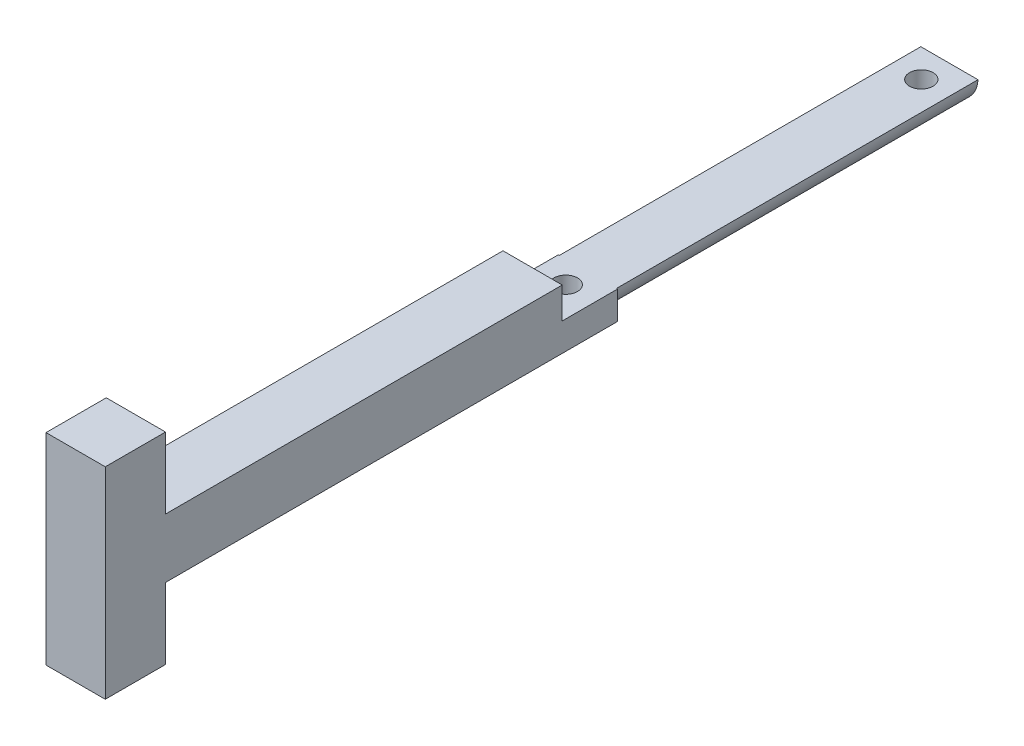
from build123d import *

# Parameters (mm, degrees)
SKETCH_1_R           = 2.85
EXTRUDE_1_DEPTH      = 31
SKETCH_3_W           = 5.9
SKETCH_3_H           = 5.9
EXTRUDE_2_DEPTH      = 5
SKETCH_4_R           = 5
EXTRUDE_3_DEPTH      = 7
SKETCH_6_R           = 11.5
EXTRUDE_4_DEPTH      = 2
SKETCH_8_R           = 4.5
CUT_EXTRUDE_2_DEPTH  = 7.5
SKETCH_9_R           = 1.25
CUT_EXTRUDE_3_DEPTH  = 5.5
SKETCH_10_R          = 1.175
CUT_EXTRUDE_7_DEPTH  = 10
SKETCH_12_W          = 5.9
SKETCH_12_H          = 5.9
EXTRUDE_5_DEPTH      = 45
SKETCH_15_W          = 5.9
SKETCH_15_H          = 20.04910328
EXTRUDE_6_DEPTH      = 6
SKETCH_16_R          = 1.175
CUT_EXTRUDE_8_DEPTH  = 10
SKETCH_21_W          = 41.5
SKETCH_21_H          = 3.1
CUT_EXTRUDE_9_DEPTH  = 10
SKETCH_22_OUTSIDE_W  = 45.272
SKETCH_22_OUTSIDE_H  = 45.272
SKETCH_22_OUTSIDE_R  = 2.85
CUT_EXTRUDE_10_DEPTH = 5
SKETCH_23_R          = 14.411618967
CUT_EXTRUDE_11_DEPTH = 9


with BuildPart() as part:
    # 스케치1 → 보스-돌출1 (new body)
    with BuildSketch(Plane.XY):
        Circle(SKETCH_1_R)
    extrude(amount=EXTRUDE_1_DEPTH)

    # 스케치3 → 보스-돌출2 (add)
    with BuildSketch(Plane(origin=(0, 0, 0), x_dir=(-1, 0, 0), z_dir=(0, 0, -1))):
        Rectangle(SKETCH_3_W, SKETCH_3_H)
    extrude(amount=EXTRUDE_2_DEPTH)

    # 스케치4 → 보스-돌출3 (add)
    with BuildSketch(Plane(origin=(0, 0, -5), x_dir=(-1, 0, 0), z_dir=(0, 0, -1))):
        Circle(SKETCH_4_R)
    extrude(amount=EXTRUDE_3_DEPTH)

    # 스케치6 → 보스-돌출4 (add)
    with BuildSketch(Plane(origin=(0, 0, -12), x_dir=(-1, 0, 0), z_dir=(0, 0, -1))):
        Circle(SKETCH_6_R)
    extrude(amount=EXTRUDE_4_DEPTH)

    # 스케치8 → 컷-돌출2 (cut)
    with BuildSketch(Plane(origin=(0, 0, -14), x_dir=(-1, 0, 0), z_dir=(0, 0, -1))):
        Circle(SKETCH_8_R)
    extrude(amount=-CUT_EXTRUDE_2_DEPTH, mode=Mode.SUBTRACT)

    # 스케치9 → 컷-돌출3 (cut)
    with BuildSketch(Plane(origin=(0, 0, -14), x_dir=(-1, 0, 0), z_dir=(0, 0, -1))):
        with Locations((3.444150891, 8.314915793)):
            Circle(SKETCH_9_R)
        with Locations((-3.444150891, 8.314915793)):
            Circle(SKETCH_9_R)
        with Locations((8.314915793, 3.444150891)):
            Circle(SKETCH_9_R)
        with Locations((8.314915793, -3.444150891)):
            Circle(SKETCH_9_R)
        with Locations((3.444150891, -8.314915793)):
            Circle(SKETCH_9_R)
        with Locations((-3.444150891, -8.314915793)):
            Circle(SKETCH_9_R)
        with Locations((-8.314915793, -3.444150891)):
            Circle(SKETCH_9_R)
        with Locations((-8.314915793, 3.444150891)):
            Circle(SKETCH_9_R)
    extrude(amount=-CUT_EXTRUDE_3_DEPTH, mode=Mode.SUBTRACT)

    # 스케치10 → 컷-돌출7 (cut)
    with BuildSketch(Plane(origin=(0, 2.95, 0), x_dir=(1, 0, 0), z_dir=(0, 1, 0))):
        with Locations(Location((0, 2.2, 0), (0, 0, 180))):
            Circle(SKETCH_10_R)
    extrude(amount=-CUT_EXTRUDE_7_DEPTH, mode=Mode.SUBTRACT)

    # 스케치12 → 보스-돌출5 (add)
    with BuildSketch(Plane.XY.offset(31)):
        Rectangle(SKETCH_12_W, SKETCH_12_H)
    extrude(amount=EXTRUDE_5_DEPTH)

    # 스케치15 → 보스-돌출6 (add)
    with BuildSketch(Plane.XY.offset(76)):
        Rectangle(SKETCH_15_W, SKETCH_15_H)
    extrude(amount=EXTRUDE_6_DEPTH)

    # 스케치16 → 컷-돌출8 (cut)
    with BuildSketch(Plane(origin=(0, 2.95, 0), x_dir=(1, 0, 0), z_dir=(0, 1, 0))):
        with Locations(Location((0, -33.2, 0), (0, 0, 270))):
            Circle(SKETCH_16_R)
    extrude(amount=-CUT_EXTRUDE_8_DEPTH, mode=Mode.SUBTRACT)

    # 스케치21 → 컷-돌출9 (cut)
    with BuildSketch(Plane(origin=(2.95, 0, 0), x_dir=(0, 0, -1), z_dir=(1, 0, 0))):
        with Locations((-15.75, 1.4)):
            Rectangle(SKETCH_21_W, SKETCH_21_H)
    extrude(amount=-CUT_EXTRUDE_9_DEPTH, mode=Mode.SUBTRACT)

    # 스케치22 outside → 컷-돌출10 (cut)
    with BuildSketch(Plane.XY):
        Rectangle(SKETCH_22_OUTSIDE_W, SKETCH_22_OUTSIDE_H)
        Circle(SKETCH_22_OUTSIDE_R, mode=Mode.SUBTRACT)
    extrude(amount=-CUT_EXTRUDE_10_DEPTH, mode=Mode.SUBTRACT)

    # 스케치23 → 컷-돌출11 (cut)
    with BuildSketch(Plane(origin=(0, 0, -14), x_dir=(-1, 0, 0), z_dir=(0, 0, -1))):
        Circle(SKETCH_23_R)
    extrude(amount=-CUT_EXTRUDE_11_DEPTH, mode=Mode.SUBTRACT)


solid = part.part
